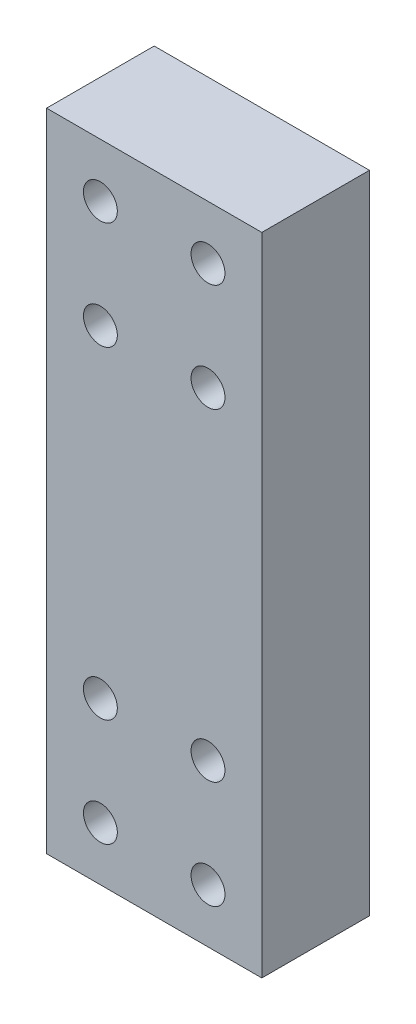
from build123d import *

# Parameters (mm, degrees)
SKETCH_1_W          = 20
SKETCH_1_H          = 60
EXTRUDE_1_DEPTH     = 10
SKETCH_2_R          = 1.575
CUT_EXTRUDE_1_DEPTH = 65.031242374


with BuildPart() as part:
    # 草图1 → 凸台-拉伸1 (new body)
    with BuildSketch(Plane.XY):
        with Locations((10, -30)):
            Rectangle(SKETCH_1_W, SKETCH_1_H)
    extrude(amount=EXTRUDE_1_DEPTH)

    # 草图2 → 切除-拉伸1 (cut, through all)
    with BuildSketch(Plane.XY.offset(10)):
        with Locations((5, -5)):
            Circle(SKETCH_2_R)
        with Locations(Location((15, -5, 0), (0, 0, 180))):
            Circle(SKETCH_2_R)
        with Locations((15, -15)):
            Circle(SKETCH_2_R)
        with Locations(Location((5, -15, 0), (0, 0, 180))):
            Circle(SKETCH_2_R)
        with Locations((5, -45)):
            Circle(SKETCH_2_R)
        with Locations(Location((15, -45, 0), (0, 0, 180))):
            Circle(SKETCH_2_R)
        with Locations((15, -55)):
            Circle(SKETCH_2_R)
        with Locations(Location((5, -55, 0), (0, 0, 180))):
            Circle(SKETCH_2_R)
    extrude(amount=-CUT_EXTRUDE_1_DEPTH, mode=Mode.SUBTRACT)


solid = part.part
